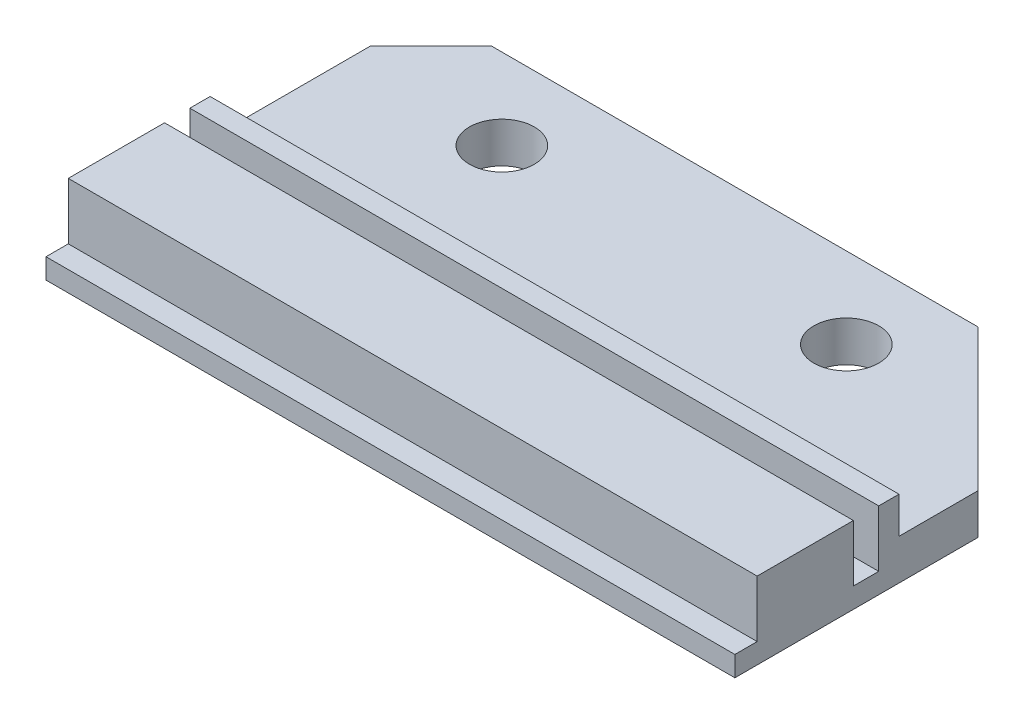
from build123d import *

# Parameters (mm, degrees)
SKETCH_1_W          = 32
SKETCH_1_H          = 19
SKETCH_1_R          = 1.6
EXTRUDE_1_DEPTH     = 1
SKETCH_3_W          = 32
SKETCH_3_H          = 4.75
EXTRUDE_2_DEPTH     = 2.8
SKETCH_4_W          = 32
SKETCH_4_H          = 1
EXTRUDE_3_DEPTH     = 2.8
EXTRUDE_4_DEPTH     = 2
EXTRUDE_5_DEPTH     = 7
CHAMFER_1_SIZE      = 7
SKETCH_7_R          = 1.6
EXTRUDE_6_DEPTH     = 1
SKETCH_8_W          = 4
SKETCH_8_H          = 16
CUT_EXTRUDE_1_DEPTH = 31.686967918
SKETCH_9_W          = 27
SKETCH_9_H          = 1.5
CUT_EXTRUDE_2_DEPTH = 1
SKETCH_10_W         = 3
SKETCH_10_H         = 19
CUT_EXTRUDE_3_DEPTH = 31.686967918
CHAMFER_2_SIZE      = 3


with BuildPart() as part:
    # 草图1 → 凸台-拉伸1 (new body)
    with BuildSketch(Plane(origin=(0, 0, 0), x_dir=(1, 0, 0), z_dir=(0, 1, 0))):
        with Locations((8.5, -5.5)):
            Rectangle(SKETCH_1_W, SKETCH_1_H)
        with Locations(Location((0, 0, 0), (0, 0, 270))):
            Circle(SKETCH_1_R, mode=Mode.SUBTRACT)
        with Locations(Location((17, 0, 0), (0, 0, 270))):
            Circle(SKETCH_1_R, mode=Mode.SUBTRACT)
    extrude(amount=EXTRUDE_1_DEPTH)

    # 草图3 → 凸台-拉伸2 (add)
    with BuildSketch(Plane(origin=(0, 1, 0), x_dir=(1, 0, 0), z_dir=(0, 1, 0))):
        with Locations((8.5, -11.525)):
            Rectangle(SKETCH_3_W, SKETCH_3_H)
    extrude(amount=EXTRUDE_2_DEPTH)

    # 草图4 → 凸台-拉伸3 (add)
    with BuildSketch(Plane(origin=(0, 1, 0), x_dir=(1, 0, 0), z_dir=(0, 1, 0))):
        with Locations((8.5, -7.4)):
            Rectangle(SKETCH_4_W, SKETCH_4_H)
    extrude(amount=EXTRUDE_3_DEPTH)

    # 草图5 → 凸台-拉伸4 (add)
    with BuildSketch(Plane(origin=(24.5, 0, 0), x_dir=(0, 0, -1), z_dir=(1, 0, 0))):
        Polygon((-15, 0), (4, 0), (4, 1), (-6.9, 1), (-6.9, 3.8), (-7.9, 3.8), (-7.9, 1), (-9.15, 1), (-9.15, 3.8), (-13.9, 3.8), (-13.9, 1), (-15, 1), align=None)
    extrude(amount=EXTRUDE_4_DEPTH)

    # 草图6 → 凸台-拉伸5 (add)
    with BuildSketch(Plane.ZY.offset(7.5)):
        Polygon((-4, 0), (15, 0), (15, 1), (13.9, 1), (13.9, 3.8), (9.15, 3.8), (9.15, 1), (7.9, 1), (7.9, 3.8), (6.9, 3.8), (6.9, 1), (-4, 1), align=None)
    extrude(amount=EXTRUDE_5_DEPTH)

    # 倒角1
    chamfer_1_edges = [part.edges().sort_by_distance(p)[0] for p in [
        (26.5, 0.5, -4),
        (-14.5, 0.5, -4),
    ]]
    chamfer(chamfer_1_edges, length=CHAMFER_1_SIZE)

    # 草图7 → 凸台-拉伸6 (add)
    with BuildSketch(Plane(origin=(0, 1, 0), x_dir=(1, 0, 0), z_dir=(0, 1, 0))):
        Polygon((26.5, -6.9), (26.5, -3), (19.5, 4), (-7.5, 4), (-14.5, -3), (-14.5, -6.9), align=None)
        with Locations(Location((17, 0, 0), (0, 0, 270))):
            Circle(SKETCH_7_R, mode=Mode.SUBTRACT)
        with Locations(Location((0, 0, 0), (0, 0, 270))):
            Circle(SKETCH_7_R, mode=Mode.SUBTRACT)
    extrude(amount=EXTRUDE_6_DEPTH)

    # 草图8 → 切除-拉伸1 (cut, through all)
    with BuildSketch(Plane(origin=(0, 3.8, 0), x_dir=(1, 0, 0), z_dir=(0, 1, 0))):
        with Locations((-12.5, -7)):
            Rectangle(SKETCH_8_W, SKETCH_8_H)
    extrude(amount=-CUT_EXTRUDE_1_DEPTH, mode=Mode.SUBTRACT)

    # 草图9 → 切除-拉伸2 (cut)
    with BuildSketch(Plane(origin=(0, 2, 0), x_dir=(1, 0, 0), z_dir=(0, 1, 0))):
        with Locations((3, -6.15)):
            Rectangle(SKETCH_9_W, SKETCH_9_H)
    extrude(amount=-CUT_EXTRUDE_2_DEPTH, mode=Mode.SUBTRACT)

    # 草图10 → 切除-拉伸3 (cut, through all)
    with BuildSketch(Plane.XZ):
        with Locations((-9, 5.5)):
            Rectangle(SKETCH_10_W, SKETCH_10_H)
    extrude(amount=-CUT_EXTRUDE_3_DEPTH, mode=Mode.SUBTRACT)

    # 倒角2
    chamfer_2_edges = [part.edges().sort_by_distance(p)[0] for p in [
        (-7.5, 1, -4),
    ]]
    chamfer(chamfer_2_edges, length=CHAMFER_2_SIZE)


solid = part.part
